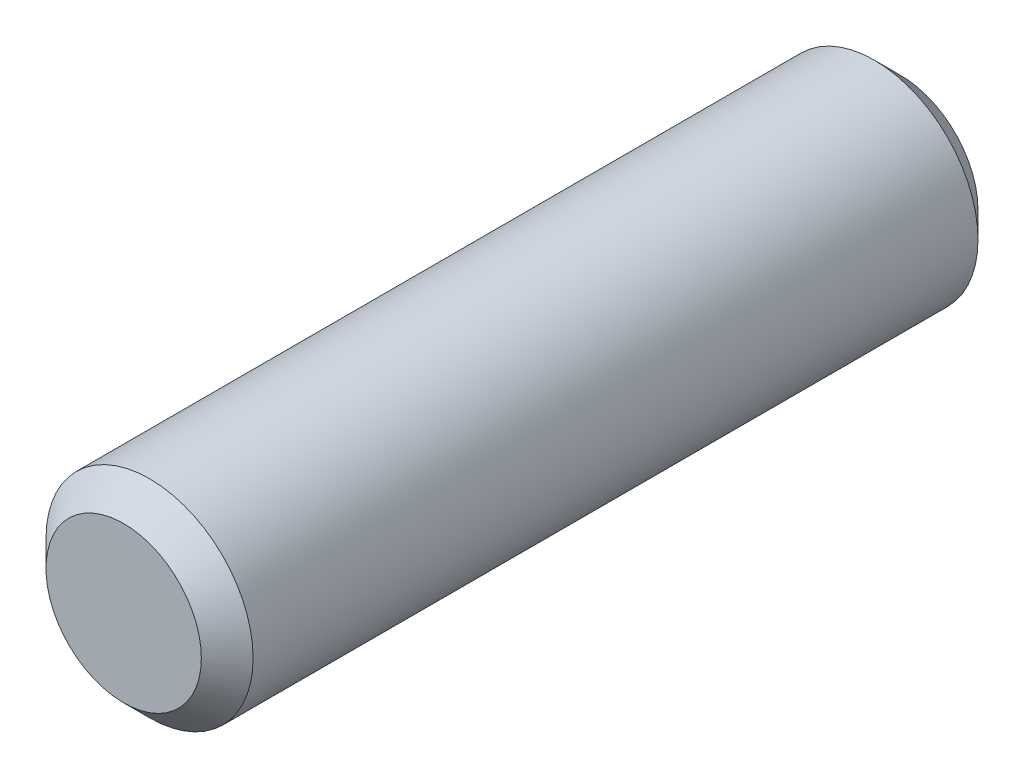
from build123d import *

# Parameters (mm, degrees)
SKETCH1_R           = 1
BOSS_EXTRUDE1_DEPTH = 7.5
CHAMFER1_SIZE       = 0.25


with BuildPart() as part:
    # Sketch1 → Boss-Extrude1 (new body)
    with BuildSketch(Plane.XY):
        Circle(SKETCH1_R)
    extrude(amount=BOSS_EXTRUDE1_DEPTH)

    # Chamfer1
    chamfer1_edges = [part.edges().sort_by_distance(p)[0] for p in [
        (-1, 0, 0),
        (-1, 0, 7.5),
    ]]
    chamfer(chamfer1_edges, length=CHAMFER1_SIZE)


solid = part.part
